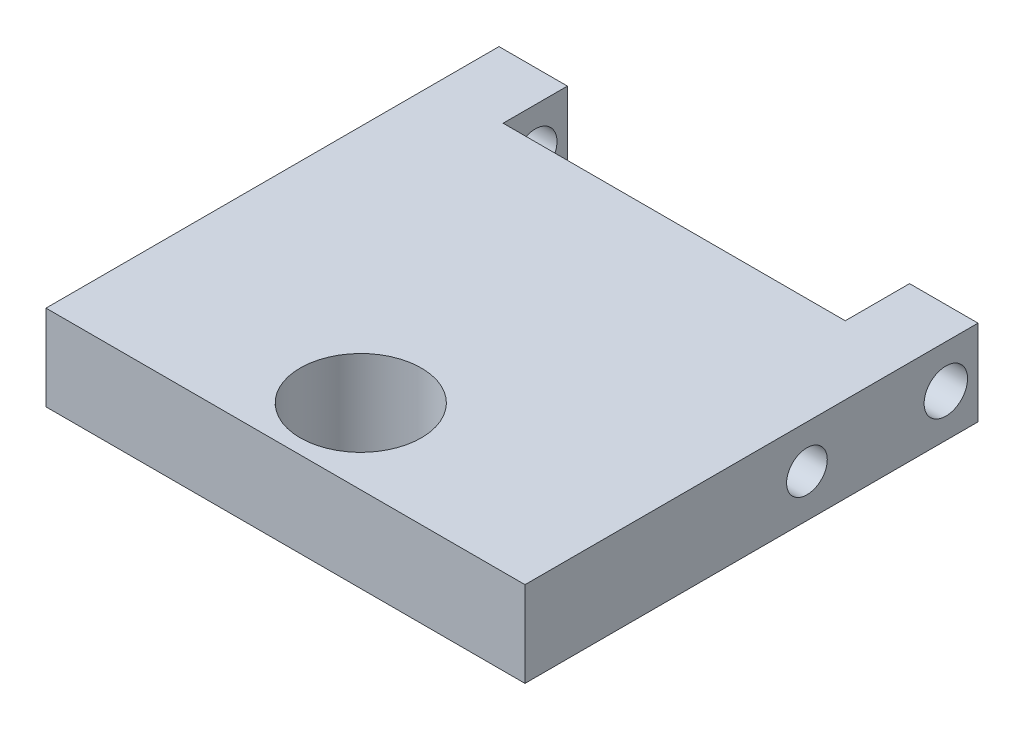
from build123d import *

# Parameters (mm, degrees)
SKETCH1_W             = 17.78
SKETCH1_H             = 16.8148
BOSS_EXTRUDE1_DEPTH   = 3.175
SKETCH2_W             = 12.7
SKETCH2_H             = 4.7752
CUT_EXTRUDE1_DEPTH    = 13.64108776
F_8_CLEARANCE_HOLE1_D = 4.4958
F_0_CLEARANCE_HOLE1_D = 1.6129
F_1_72_TAPPED_HOLE1_D = 1.5113


with BuildPart() as part:
    # Sketch1 → Boss-Extrude1 (new body)
    with BuildSketch(Plane(origin=(0, 0, 0), x_dir=(1, 0, 0), z_dir=(0, 1, 0))):
        Rectangle(SKETCH1_W, SKETCH1_H)
    extrude(amount=BOSS_EXTRUDE1_DEPTH)

    # Sketch2 → Cut-Extrude1 (cut, through all)
    with BuildSketch(Plane(origin=(0, 3.175, 0), x_dir=(1, 0, 0), z_dir=(0, 1, 0))):
        with Locations((0, 8.4074)):
            Rectangle(SKETCH2_W, SKETCH2_H)
    extrude(amount=-CUT_EXTRUDE1_DEPTH, mode=Mode.SUBTRACT)

    # #8 Clearance Hole1 (through all)
    with Locations(Plane(origin=(0, 3.175, 0), x_dir=(1, 0, 0), z_dir=(0, 1, 0))):
        with Locations((0, -5.6134)):
            Hole(F_8_CLEARANCE_HOLE1_D / 2)

    # #0 Clearance Hole1 (through all)
    with Locations(Plane(origin=(8.89, 0, 0), x_dir=(0, 0, -1), z_dir=(1, 0, 0))):
        with Locations((7.2136, 1.5875)):
            Hole(F_0_CLEARANCE_HOLE1_D / 2)

    # #1-72 Tapped Hole1 (through all)
    with Locations(Plane(origin=(8.89, 0, 0), x_dir=(0, 0, -1), z_dir=(1, 0, 0))):
        with Locations((2.0574, 1.5875)):
            Hole(F_1_72_TAPPED_HOLE1_D / 2)


solid = part.part
